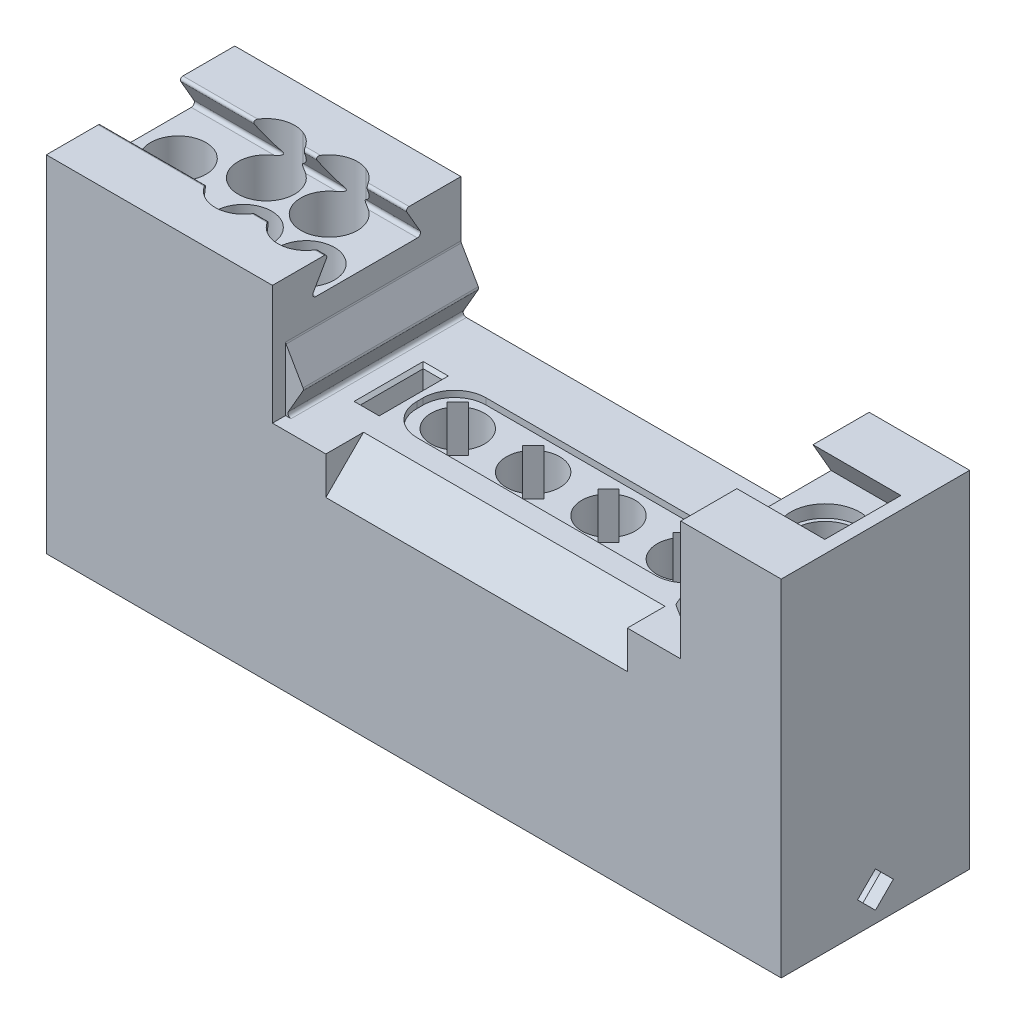
from build123d import *

# Parameters (mm, degrees)
SKETCH1_W                       = 115
SKETCH1_H                       = 30
BOSS_EXTRUDE1_DEPTH             = 27.5
CUT_EXTRUDE1_DEPTH              = 66.479004269
CUT_EXTRUDE1_DEPTH_BACK         = 66.479004269
SKETCH5_R                       = 4.4
CUT_EXTRUDE3_DEPTH              = 8
SKETCH3_R                       = 4.9
CUT_EXTRUDE2_DEPTH              = 24
SKETCH6_R                       = 3.1
CUT_EXTRUDE4_DEPTH              = 6
SKETCH7_R                       = 5.5
CUT_EXTRUDE5_DEPTH              = 2
CUT_EXTRUDE7_DEPTH              = 66.479004269
CUT_EXTRUDE7_DEPTH_BACK         = 66.479004269
FILLET2_R                       = 0.4
FILLET1_R                       = 0.5
SKETCH13_W                      = 30
SKETCH13_H                      = 55
BOSS_EXTRUDE2_DEPTH             = 2
CUT_EXTRUDE10_DEPTH             = 35
SKETCH17_W                      = 22
SKETCH17_H                      = 15
CUT_EXTRUDE11_DEPTH             = 2
FILLET6_R                       = 2
CUT_EXTRUDE13_START             = -1
CUT_EXTRUDE13_DEPTH             = 1
CUT_EXTRUDE14_DEPTH             = 105
CUT_EXTRUDE15_START             = -2
SKETCH21_R                      = 3.75
CUT_EXTRUDE15_DEPTH             = 30
CUT_EXTRUDE23_REACH             = 123.121
CUT_EXTRUDE17_DEPTH             = 2.1
SKETCH24_R                      = 4.25
CUT_EXTRUDE18_DEPTH             = 20
CUT_EXTRUDE16_REACH             = 73.142
SKETCH22_W                      = 3
SKETCH22_H                      = 10
CUT_EXTRUDE19_DEPTH             = 20
SKETCH26_W                      = 48
SKETCH26_H                      = 11
CUT_EXTRUDE20_DEPTH             = 1
FILLET7_R                       = 5
CUT_EXTRUDE21_DEPTH             = 24
CUT_EXTRUDE21_DEPTH_BACK        = 24
CHAMFER1_SIZE                   = 0.5
SKETCH28_R                      = 4.5
CUT_EXTRUDE22_DEPTH             = 17
CUT_EXTRUDE22_DIRECTION_2_REACH = 81.153


with BuildPart() as part:
    # Sketch1 → Boss-Extrude1 (new, symmetric)
    with BuildSketch(Plane(origin=(0, 0, 0), x_dir=(1, 0, 0), z_dir=(0, 1, 0))):
        Rectangle(SKETCH1_W, SKETCH1_H)
    extrude(amount=BOSS_EXTRUDE1_DEPTH, both=True)

    # Sketch2 → Cut-Extrude1 (cut, two sides: drawn at the far end of the back side and taken through both)
    with BuildSketch(Plane(origin=(0, 0, 0), x_dir=(0, 0, -1), z_dir=(1, 0, 0)).offset(-CUT_EXTRUDE1_DEPTH_BACK)):
        Polygon((-6.056624327, 27.5), (-8.943375673, 22.5), (8.943375673, 22.5), (6.056624327, 27.5), (0, 27.5), align=None)
    extrude(amount=CUT_EXTRUDE1_DEPTH + CUT_EXTRUDE1_DEPTH_BACK, mode=Mode.SUBTRACT)

    # Sketch5 → Cut-Extrude3 (cut)
    with BuildSketch(Plane(origin=(0, 22.5, 0), x_dir=(1, 0, 0), z_dir=(0, 1, 0))):
        with Locations(Location((-51.5, 0, 0), (0, 0, 270))):
            Circle(SKETCH5_R)
    extrude(amount=-CUT_EXTRUDE3_DEPTH, mode=Mode.SUBTRACT)

    # Sketch3 → Cut-Extrude2 (cut)
    with BuildSketch(Plane(origin=(0, 22.5, 0), x_dir=(1, 0, 0), z_dir=(0, 1, 0))):
        with Locations(Location((51.5, 0, 0), (0, 0, 270))):
            Circle(SKETCH3_R)
    extrude(amount=-CUT_EXTRUDE2_DEPTH, mode=Mode.SUBTRACT)

    # Sketch6 → Cut-Extrude4 (cut)
    with BuildSketch(Plane(origin=(0, 14.5, 0), x_dir=(1, 0, 0), z_dir=(0, 1, 0))):
        with Locations(Location((-51.5, 0, 0), (0, 0, 270))):
            Circle(SKETCH6_R)
    extrude(amount=-CUT_EXTRUDE4_DEPTH, mode=Mode.SUBTRACT)

    # Sketch7 → Cut-Extrude5 (cut)
    with BuildSketch(Plane(origin=(0, 22.5, 0), x_dir=(1, 0, 0), z_dir=(0, 1, 0))):
        with Locations(Location((51.5, 0, 0), (0, 0, 270))):
            Circle(SKETCH7_R)
    extrude(amount=-CUT_EXTRUDE5_DEPTH, mode=Mode.SUBTRACT)

    # Sketch10 → Cut-Extrude7 (cut, two sides: drawn at the far end of the back side and taken through both)
    with BuildSketch(Plane.XY.offset(-CUT_EXTRUDE7_DEPTH_BACK)):
        Polygon((-21.5, 27.5), (-21.5, 18.5), (-18.613248654, 13.5), (-21.5, 8.5), (43.5, 8.5), (40.613248654, 13.5), (43.5, 18.5), (43.5, 27.5), align=None)
    extrude(amount=CUT_EXTRUDE7_DEPTH + CUT_EXTRUDE7_DEPTH_BACK, mode=Mode.SUBTRACT)

    # Fillet2
    fillet2_edges = [part.edges().sort_by_distance(p)[0] for p in [
        (-39.5, 27.5, -6.056624327),
        (-39.5, 27.5, 6.056624327),
        (40.613248654, 13.5, 0),
        (-18.613248654, 13.5, 0),
    ]]
    fillet(fillet2_edges, radius=FILLET2_R)

    # Fillet1
    fillet1_edges = [part.edges().sort_by_distance(p)[0] for p in [
        (-39.5, 22.5, -8.943375673),
        (-39.5, 22.5, 8.943375673),
        (-21.5, 18.5, 0),
        (43.5, 18.5, 0),
        (43.5, 8.5, 0),
        (-21.5, 8.5, 0),
    ]]
    fillet(fillet1_edges, radius=FILLET1_R)

    # Sketch13 → Boss-Extrude2 (add)
    with BuildSketch(Plane(origin=(57.5, 0, 0), x_dir=(0, 0, -1), z_dir=(1, 0, 0))):
        Rectangle(SKETCH13_W, SKETCH13_H)
    extrude(amount=BOSS_EXTRUDE2_DEPTH)

    # Sketch16 → Cut-Extrude10 (cut)
    with BuildSketch(Plane.ZY.offset(57.5)):
        Polygon((-11, -12.5), (-11, -7.5), (-2, 1.5), (2, 1.5), (11, -7.5), (11, -12.5), align=None)
    extrude(amount=-CUT_EXTRUDE10_DEPTH, mode=Mode.SUBTRACT)

    # Sketch17 → Cut-Extrude11 (cut)
    with BuildSketch(Plane.ZY.offset(57.5)):
        with Locations((0, -20)):
            Rectangle(SKETCH17_W, SKETCH17_H)
    extrude(amount=-CUT_EXTRUDE11_DEPTH, mode=Mode.SUBTRACT)

    # Fillet6
    fillet6_edges = [part.edges().sort_by_distance(p)[0] for p in [
        (-40, -7.5, -11),
        (-40, 1.5, -2),
        (-40, 1.5, 2),
        (-40, -7.5, 11),
    ]]
    fillet(fillet6_edges, radius=FILLET6_R)

    # Sketch18 → Cut-Extrude13 (cut)
    with BuildSketch(Plane.ZY.offset(57.5).offset(CUT_EXTRUDE13_START)):
        with BuildLine():
            Line((-13, -27.5), (13, -27.5))
            Line((13, -27.5), (13, -8.328427125))
            ThreePointArc((13, -8.328427125), (12.69551813, -6.797693395), (11.828427125, -5.5))
            Line((11.828427125, -5.5), (4, 2.328427125))
            ThreePointArc((4, 2.328427125), (2.702306605, 3.19551813), (1.171572875, 3.5))
            Line((1.171572875, 3.5), (-1.171572875, 3.5))
            ThreePointArc((-1.171572875, 3.5), (-2.702306605, 3.19551813), (-4, 2.328427125))
            Line((-4, 2.328427125), (-11.828427125, -5.5))
            ThreePointArc((-11.828427125, -5.5), (-12.69551813, -6.797693395), (-13, -8.328427125))
            Line((-13, -8.328427125), (-13, -27.5))
        make_face()
    extrude(amount=-CUT_EXTRUDE13_DEPTH, mode=Mode.SUBTRACT)

    # Sketch19 → Cut-Extrude14 (cut)
    with BuildSketch(Plane.ZY.offset(55.5)):
        Polygon((5.656854249, -20), (0, -14.343145751), (-5.656854249, -20), (0, -25.656854249), align=None)
    extrude(amount=-CUT_EXTRUDE14_DEPTH, mode=Mode.SUBTRACT)

    # Sketch21 → Cut-Extrude15 (cut)
    with BuildSketch(Plane(origin=(59.5, 0, 0), x_dir=(0, 0, -1), z_dir=(1, 0, 0)).offset(CUT_EXTRUDE15_START)):
        with Locations((0, -22.803300859)):
            Circle(SKETCH21_R)
    extrude(amount=-CUT_EXTRUDE15_DEPTH, mode=Mode.SUBTRACT)

    # Sketch29 → Cut-Extrude23 (cut, up to next)
    with BuildSketch(Plane(origin=(59.5, 0, 0), x_dir=(0, 0, -1), z_dir=(1, 0, 0)), mode=Mode.PRIVATE) as cut_extrude23_sk1:
        Polygon((0, -25.656854249), (-2.853553391, -22.803300859), (0, -19.949747468), (2.853553391, -22.803300859), align=None)
    cut_extrude23_tool1 = extrude(cut_extrude23_sk1.sketch, amount=-CUT_EXTRUDE23_REACH, mode=Mode.PRIVATE) & part.part
    add(cut_extrude23_tool1.solids().sort_by_distance((59.5, -22.803301, 0))[0], mode=Mode.SUBTRACT)

    # Sketch23 → Cut-Extrude17 (cut)
    with BuildSketch(Plane.XY.offset(15)):
        Polygon((-21.5, 18.633974596), (-21.5, 8.5), (-20.633974596, 8.5), (42.633974596, 8.5), (43.5, 8.5), (43.5, 18.633974596), align=None)
    extrude(amount=-CUT_EXTRUDE17_DEPTH, mode=Mode.SUBTRACT)

    # Sketch24 → Cut-Extrude18 (cut)
    with BuildSketch(Plane(origin=(0, 8.5, 0), x_dir=(1, 0, 0), z_dir=(0, 1, 0))):
        with Locations(Location((-7, 0, 0), (0, 0, 270))):
            Circle(SKETCH24_R)
        with Locations(Location((29, 0, 0), (0, 0, 90))):
            Circle(SKETCH24_R)
        with Locations(Location((5, 0, 0), (0, 0, 270))):
            Circle(SKETCH24_R)
        with Locations(Location((17, 0, 0), (0, 0, 90))):
            Circle(SKETCH24_R)
    extrude(amount=-CUT_EXTRUDE18_DEPTH, mode=Mode.SUBTRACT)

    # Sketch22 → Cut-Extrude16 (cut, up to next)
    with BuildSketch(Plane(origin=(0, 8.5, 0), x_dir=(1, 0, 0), z_dir=(0, 1, 0)), mode=Mode.PRIVATE) as cut_extrude16_sk1:
        with Locations((-16, 0)):
            Rectangle(SKETCH22_W, SKETCH22_H)
    cut_extrude16_tool1 = extrude(cut_extrude16_sk1.sketch, amount=-CUT_EXTRUDE16_REACH, mode=Mode.PRIVATE) & part.part
    add(cut_extrude16_tool1.solids().sort_by_distance((-16, 8.5, 0))[0], mode=Mode.SUBTRACT)

    # Sketch25 → Cut-Extrude19 (cut)
    with BuildSketch(Plane(origin=(0, 8.5, 0), x_dir=(1, 0, 0), z_dir=(0, 1, 0))):
        Polygon((-9.828427125, 4.5254834), (-2.4745166, -2.828427125), (-4.171572875, -4.5254834), (-11.5254834, 2.828427125), align=None)
        Polygon((2.171572875, 4.5254834), (9.5254834, -2.828427125), (7.828427125, -4.5254834), (0.4745166, 2.828427125), align=None)
        Polygon((14.171572875, 4.5254834), (21.5254834, -2.828427125), (19.828427125, -4.5254834), (12.4745166, 2.828427125), align=None)
        Polygon((26.171572875, 4.5254834), (33.5254834, -2.828427125), (31.828427125, -4.5254834), (24.4745166, 2.828427125), align=None)
    extrude(amount=-CUT_EXTRUDE19_DEPTH, mode=Mode.SUBTRACT)

    # Sketch26 → Cut-Extrude20 (cut)
    with BuildSketch(Plane(origin=(0, 8.5, 0), x_dir=(1, 0, 0), z_dir=(0, 1, 0))):
        with Locations((11, 0)):
            Rectangle(SKETCH26_W, SKETCH26_H)
    extrude(amount=-CUT_EXTRUDE20_DEPTH, mode=Mode.SUBTRACT)

    # Fillet7
    fillet7_edges = [part.edges().sort_by_distance(p)[0] for p in [
        (-13, 8, 5.5),
        (-13, 8, -5.5),
        (35, 8, -5.5),
        (35, 8, 5.5),
    ]]
    fillet(fillet7_edges, radius=FILLET7_R)

    # Sketch27 → Cut-Extrude21 (cut, two sides: drawn at the far end of the back side and taken through both)
    with BuildSketch(Plane(origin=(11, 0, 0), x_dir=(0, 0, -1), z_dir=(1, 0, 0)).offset(-CUT_EXTRUDE21_DEPTH_BACK)):
        Polygon((-15, 8.5), (-9, 8.5), (-15, 2.5), align=None)
    extrude(amount=CUT_EXTRUDE21_DEPTH + CUT_EXTRUDE21_DEPTH_BACK, mode=Mode.SUBTRACT)

    # Chamfer1
    chamfer1_edges = [part.edges().sort_by_distance(p)[0] for p in [
        (-17.5, 8.5, 0),
        (-16, 8.5, 5),
        (-14.5, 8.5, 0),
        (-16, 8.5, -5),
    ]]
    chamfer(chamfer1_edges, length=CHAMFER1_SIZE)

    # Sketch28 → Cut-Extrude22 (cut)
    with BuildSketch(Plane(origin=(0, 22.5, 0), x_dir=(1, 0, 0), z_dir=(0, 1, 0))):
        with Locations(Location((-41.8, 4.330127019, 0), (0, 0, 68.270383407))):
            Circle(SKETCH28_R)
        with Locations(Location((-36.8, -4.330127019, 0), (0, 0, 207.428807297))):
            Circle(SKETCH28_R)
        with Locations(Location((-31.8, 4.330127019, 0), (0, 0, 68.270383407))):
            Circle(SKETCH28_R)
        with Locations(Location((-26.8, -4.330127019, 0), (0, 0, 207.428807297))):
            Circle(SKETCH28_R)
    extrude(amount=-CUT_EXTRUDE22_DEPTH, mode=Mode.SUBTRACT)

    # Sketch28 → Cut-Extrude22 direction 2 (cut, up to next)
    with BuildSketch(Plane(origin=(0, 22.5, 0), x_dir=(1, 0, 0), z_dir=(0, 1, 0)), mode=Mode.PRIVATE) as cut_extrude22_direction_2_sk1:
        with Locations(Location((-41.8, 4.330127019, 0), (0, 0, 68.270383407))):
            Circle(SKETCH28_R)
    cut_extrude22_direction_2_tool1 = extrude(cut_extrude22_direction_2_sk1.sketch, amount=CUT_EXTRUDE22_DIRECTION_2_REACH, mode=Mode.PRIVATE) & part.part
    # Sketch28 → Cut-Extrude22 direction 2 (cut, up to next)
    with BuildSketch(Plane(origin=(0, 22.5, 0), x_dir=(1, 0, 0), z_dir=(0, 1, 0)), mode=Mode.PRIVATE) as cut_extrude22_direction_2_sk2:
        with Locations(Location((-36.8, -4.330127019, 0), (0, 0, 207.428807297))):
            Circle(SKETCH28_R)
    cut_extrude22_direction_2_tool2 = extrude(cut_extrude22_direction_2_sk2.sketch, amount=CUT_EXTRUDE22_DIRECTION_2_REACH, mode=Mode.PRIVATE) & part.part
    # Sketch28 → Cut-Extrude22 direction 2 (cut, up to next)
    with BuildSketch(Plane(origin=(0, 22.5, 0), x_dir=(1, 0, 0), z_dir=(0, 1, 0)), mode=Mode.PRIVATE) as cut_extrude22_direction_2_sk3:
        with Locations(Location((-31.8, 4.330127019, 0), (0, 0, 68.270383407))):
            Circle(SKETCH28_R)
    cut_extrude22_direction_2_tool3 = extrude(cut_extrude22_direction_2_sk3.sketch, amount=CUT_EXTRUDE22_DIRECTION_2_REACH, mode=Mode.PRIVATE) & part.part
    # Sketch28 → Cut-Extrude22 direction 2 (cut, up to next)
    with BuildSketch(Plane(origin=(0, 22.5, 0), x_dir=(1, 0, 0), z_dir=(0, 1, 0)), mode=Mode.PRIVATE) as cut_extrude22_direction_2_sk4:
        with Locations(Location((-26.8, -4.330127019, 0), (0, 0, 207.428807297))):
            Circle(SKETCH28_R)
    cut_extrude22_direction_2_tool4 = extrude(cut_extrude22_direction_2_sk4.sketch, amount=CUT_EXTRUDE22_DIRECTION_2_REACH, mode=Mode.PRIVATE) & part.part
    add(cut_extrude22_direction_2_tool1.solids().sort_by_distance((-41.8, 22.5, -4.330127))[0], mode=Mode.SUBTRACT)
    add(cut_extrude22_direction_2_tool2.solids().sort_by_distance((-36.8, 22.5, 4.330127))[0], mode=Mode.SUBTRACT)
    add(cut_extrude22_direction_2_tool3.solids().sort_by_distance((-31.8, 22.5, -4.330127))[0], mode=Mode.SUBTRACT)
    add(cut_extrude22_direction_2_tool4.solids().sort_by_distance((-26.8, 22.5, 4.330127))[0], mode=Mode.SUBTRACT)


solid = part.part
